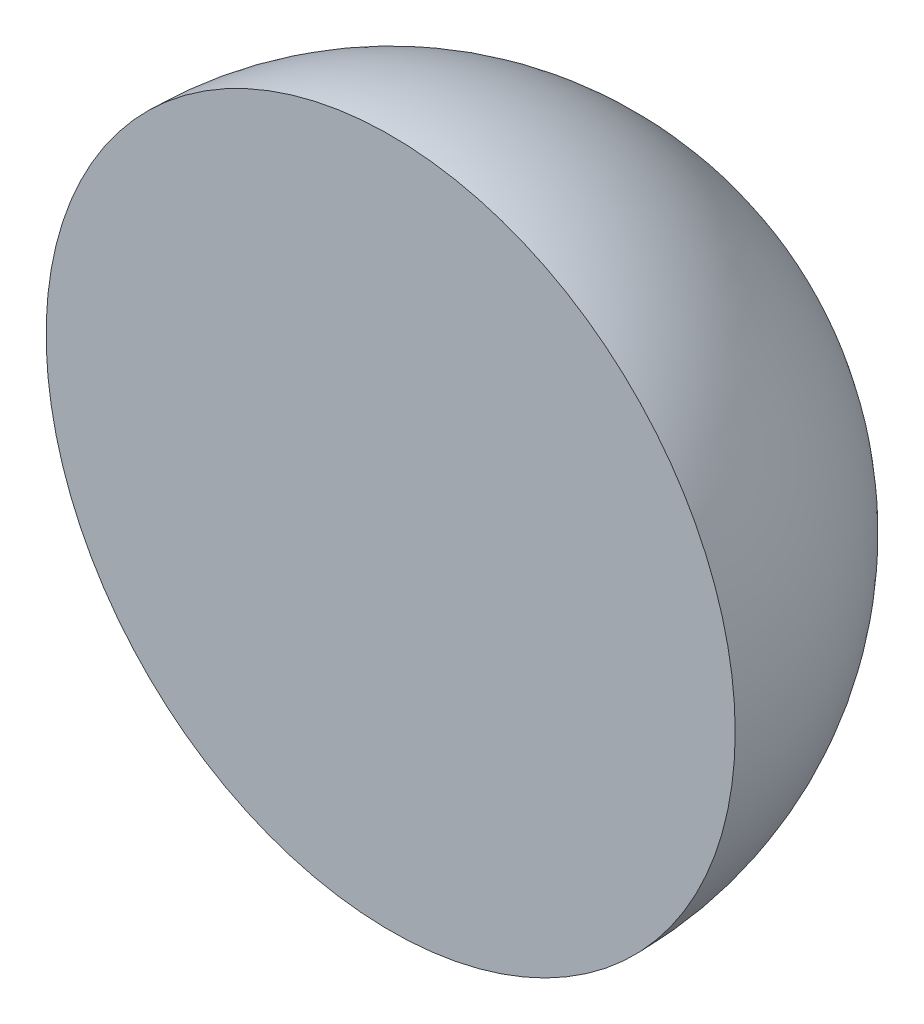
from build123d import *

# Parameters (mm, degrees)
REVOLVE1_ANGLE = 180


with BuildPart() as part:
    # Sketch1 → Revolve1 (revolve)
    with BuildSketch(Plane.XY):
        with BuildLine():
            Line((0, -5), (0, 5))
            ThreePointArc((0, 5), (5, 0), (0, -5))
        make_face()
    revolve(axis=Axis((0, -5, 0), (0, 1, 0)), revolution_arc=REVOLVE1_ANGLE)


solid = part.part
